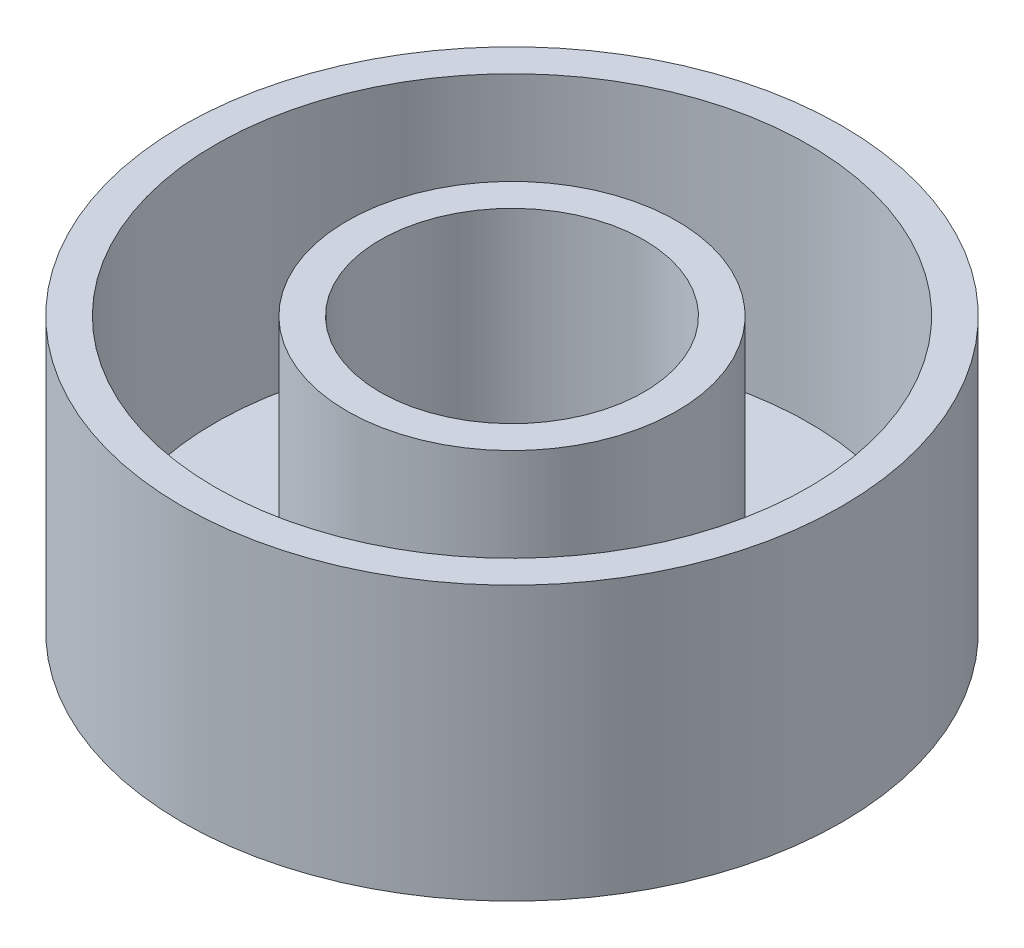
from build123d import *

# Parameters (mm, degrees)
SKETCH1_R            = 10
MAIN_EXTRUSION_DEPTH = 8.3
SKETCH2_R            = 4
ID_BORE_DEPTH        = 20
SKETCH3_R            = 9
SKETCH3_R_2          = 5
SEAL_RECESS_DEPTH    = 7.3


with BuildPart() as part:
    # Sketch1 → main extrusion (new body)
    with BuildSketch(Plane(origin=(0, 0, 0), x_dir=(1, 0, 0), z_dir=(0, 1, 0))):
        with Locations(Location((0, 0, 0), (0, 0, 90))):
            Circle(SKETCH1_R)
    extrude(amount=MAIN_EXTRUSION_DEPTH)

    # Sketch2 → ID bore (cut)
    with BuildSketch(Plane(origin=(0, 8.3, 0), x_dir=(1, 0, 0), z_dir=(0, 1, 0))):
        with Locations(Location((0, 0, 0), (0, 0, 270))):
            Circle(SKETCH2_R)
    extrude(amount=-ID_BORE_DEPTH, mode=Mode.SUBTRACT)

    # Sketch3 → seal recess (cut)
    with BuildSketch(Plane(origin=(0, 8.3, 0), x_dir=(1, 0, 0), z_dir=(0, 1, 0))):
        with Locations(Location((0, 0, 0), (0, 0, 270))):
            Circle(SKETCH3_R)
        with Locations(Location((0, 0, 0), (0, 0, 270))):
            Circle(SKETCH3_R_2, mode=Mode.SUBTRACT)
    extrude(amount=-SEAL_RECESS_DEPTH, mode=Mode.SUBTRACT)


solid = part.part
